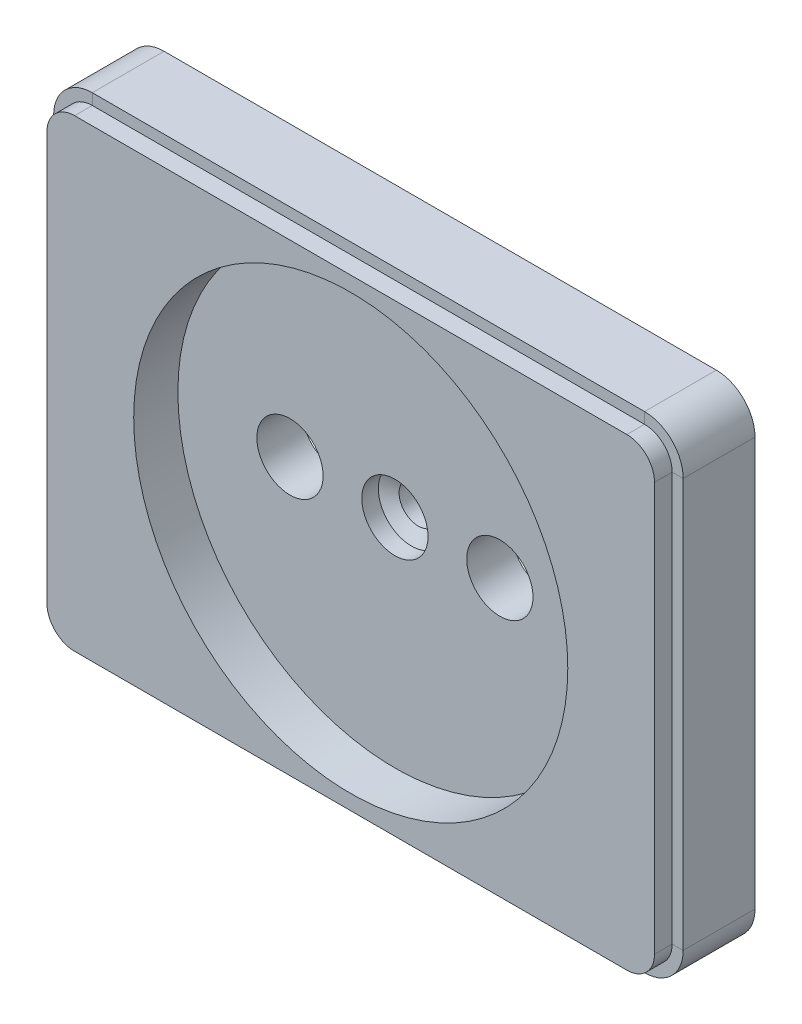
from build123d import *

# Parameters (mm, degrees)
SKETCH1_W           = 57
SKETCH1_H           = 44
SKETCH1_R           = 1.75
SKETCH1_R_2         = 3
BOSS_EXTRUDE1_DEPTH = 8.1
SKETCH2_R           = 19.65
CUT_EXTRUDE1_DEPTH  = 4
SKETCH3_R           = 3
CUT_EXTRUDE2_DEPTH  = 1.5
FILLET2_R           = 3.5
SKETCH10_W          = 1
SKETCH10_H          = 1.6


with BuildPart() as part:
    # Sketch1 → Boss-Extrude1 (new body)
    with BuildSketch(Plane.XY):
        Rectangle(SKETCH1_W, SKETCH1_H)
        Circle(SKETCH1_R, mode=Mode.SUBTRACT)
        with Locations((-9.5, 0)):
            Circle(SKETCH1_R_2, mode=Mode.SUBTRACT)
        with Locations((9.5, 0)):
            Circle(SKETCH1_R_2, mode=Mode.SUBTRACT)
    extrude(amount=BOSS_EXTRUDE1_DEPTH)

    # Sketch2 → Cut-Extrude1 (cut)
    with BuildSketch(Plane.XY.offset(8.1)):
        Circle(SKETCH2_R)
    extrude(amount=-CUT_EXTRUDE1_DEPTH, mode=Mode.SUBTRACT)

    # Sketch3 → Cut-Extrude2 (cut)
    with BuildSketch(Plane.XY.offset(4.1)):
        Circle(SKETCH3_R)
    extrude(amount=-CUT_EXTRUDE2_DEPTH, mode=Mode.SUBTRACT)

    # Sketch4 → Cut-Revolve1 (revolve, cut)
    with BuildSketch(Plane(origin=(0, 0, 0), x_dir=(1, 0, 0), z_dir=(0, 1, 0))):
        Polygon((0, -2.6), (0, -1.1), (3, -2.6), align=None)
    revolve(axis=Axis((0, 0, 2.6), (0, 0, -1)), mode=Mode.SUBTRACT)

    # Fillet2
    fillet2_edges = [part.edges().sort_by_distance(p)[0] for p in [
        (28.5, -22, 4.05),
        (-28.5, -22, 4.05),
        (-28.5, 22, 4.05),
        (28.5, 22, 4.05),
    ]]
    fillet(fillet2_edges, radius=FILLET2_R)

    # Cut-Sweep1: sweep along a path in Sketch8
    with BuildLine(Plane.XY.offset(8.1)) as cut_sweep1_path:
        Line((25, 22), (-25, 22))
        ThreePointArc((-25, 22), (-27.474873734, 20.974873734), (-28.5, 18.5))
        Line((-28.5, 18.5), (-28.5, -18.5))
        ThreePointArc((-28.5, -18.5), (-27.474873734, -20.974873734), (-25, -22))
        Line((-25, -22), (25, -22))
        ThreePointArc((25, -22), (27.474873734, -20.974873734), (28.5, -18.5))
        Line((28.5, -18.5), (28.5, 18.5))
        ThreePointArc((28.5, 18.5), (27.474873734, 20.974873734), (25, 22))
    # Sketch10 → Cut-Sweep1 (sweep, cut)
    with BuildSketch(Plane(origin=(0, 0, 0), x_dir=(1, 0, 0), z_dir=(0, 1, 0))):
        with Locations((-28, -7.3)):
            Rectangle(SKETCH10_W, SKETCH10_H)
    sweep(path=cut_sweep1_path.line, mode=Mode.SUBTRACT)


solid = part.part
